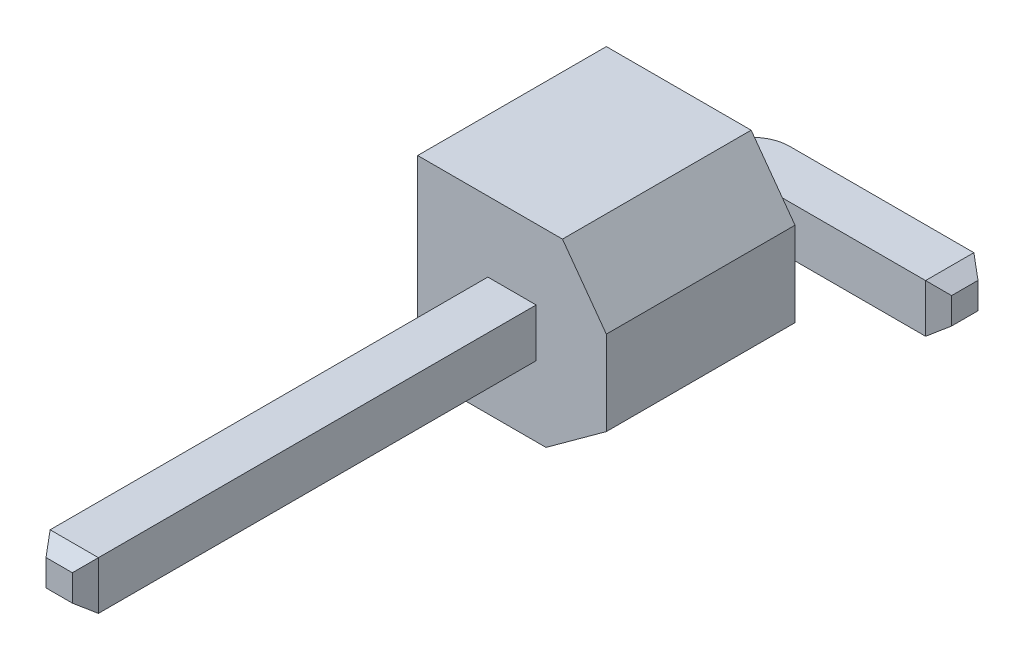
from build123d import *
from OCP.BRepFilletAPI import BRepFilletAPI_MakeChamfer

# Parameters (mm, degrees)
SKETCH_1_W           = 2.5
SKETCH_1_H           = 2.5
EXTRUDE_1_DEPTH      = 2.5
EXTRUDE_2_DEPTH      = 6
EXTRUDE_2_DEPTH_BACK = 3.5
SKETCH_2_W           = 0.64
SKETCH_2_H           = 0.64
SKETCH_4_W           = 0.64
SKETCH_4_H           = 0.64
EXTRUDE_4_DEPTH      = 2.5
FILLET_1_R           = 0.5
CHAMFER_1_SIZE       = 0.2
CHAMFER_1_SIZE2      = 0.145308506
CHAMFER_2_SIZE       = 0.8
CHAMFER_2_SIZE2      = 0.581234022


with BuildPart() as part:
    # Эскиз1 → Бобышка-Вытянуть1 (new body)
    with BuildSketch(Plane.XY.offset(1)):
        Rectangle(SKETCH_1_W, SKETCH_1_H)
    extrude(amount=EXTRUDE_1_DEPTH)

    # Эскиз2 → Бобышка-Вытянуть2 (add, two sides: drawn at the far end of the back side and taken through both)
    with BuildSketch(Plane.XY.offset(3.5).offset(-EXTRUDE_2_DEPTH_BACK)):
        Rectangle(SKETCH_2_W, SKETCH_2_H)
    extrude(amount=EXTRUDE_2_DEPTH + EXTRUDE_2_DEPTH_BACK)

    # Эскиз4 → Бобышка-Вытянуть4 (add)
    with BuildSketch(Plane(origin=(0.32, 0, 0), x_dir=(0, 0, -1), z_dir=(1, 0, 0))):
        with Locations((-0.32, 0)):
            Rectangle(SKETCH_4_W, SKETCH_4_H)
    extrude(amount=EXTRUDE_4_DEPTH)

    # Скругление1
    fillet_1_edges = [part.edges().sort_by_distance(p)[0] for p in [
        (-0.32, 0, 0),
    ]]
    fillet(fillet_1_edges, radius=FILLET_1_R)

    # Фаска1: one chamfer whose edges measure the first distance from different faces: ONE call of the kernel's chamfer builder (chamfer() names one face for all edges)
    chamfer_1_edges_1 = [part.edges().sort_by_distance(p)[0] for p in [
        (0.32, 0, 9.5),
    ]]
    chamfer_1_side_1 = [part.faces().sort_by_distance(p)[0] for p in [
        (0.32, 0, 6.5),
    ]]
    chamfer_1_edges_2 = [part.edges().sort_by_distance(p)[0] for p in [
        (0, 0.32, 9.5),
    ]]
    chamfer_1_side_2 = [part.faces().sort_by_distance(p)[0] for p in [
        (0, 0.32, 6.5),
    ]]
    chamfer_1_edges_3 = [part.edges().sort_by_distance(p)[0] for p in [
        (-0.32, 0, 9.5),
    ]]
    chamfer_1_side_3 = [part.faces().sort_by_distance(p)[0] for p in [
        (-0.32, 0, 6.5),
    ]]
    chamfer_1_edges_4 = [part.edges().sort_by_distance(p)[0] for p in [
        (0, -0.32, 9.5),
    ]]
    chamfer_1_side_4 = [part.faces().sort_by_distance(p)[0] for p in [
        (0, -0.32, 6.5),
    ]]
    chamfer_1_edges_5 = [part.edges().sort_by_distance(p)[0] for p in [
        (2.82, 0, 0),
    ]]
    chamfer_1_side_5 = [part.faces().sort_by_distance(p)[0] for p in [
        (1.5, 0, 0),
    ]]
    chamfer_1_edges_6 = [part.edges().sort_by_distance(p)[0] for p in [
        (2.82, 0.32, 0.32),
    ]]
    chamfer_1_side_6 = [part.faces().sort_by_distance(p)[0] for p in [
        (1.154058948, 0.32, 0.3778024),
    ]]
    chamfer_1_edges_7 = [part.edges().sort_by_distance(p)[0] for p in [
        (2.82, 0, 0.64),
    ]]
    chamfer_1_side_7 = [part.faces().sort_by_distance(p)[0] for p in [
        (1.57, 0, 0.64),
    ]]
    chamfer_1_edges_8 = [part.edges().sort_by_distance(p)[0] for p in [
        (2.82, -0.32, 0.32),
    ]]
    chamfer_1_side_8 = [part.faces().sort_by_distance(p)[0] for p in [
        (1.154058948, -0.32, 0.3778024),
    ]]
    chamfer_1 = BRepFilletAPI_MakeChamfer(part.part.solid().wrapped)
    for e in chamfer_1_edges_1:
        chamfer_1.Add(CHAMFER_1_SIZE, CHAMFER_1_SIZE2, e.wrapped, chamfer_1_side_1[0].wrapped)  # the first distance lies on this face
    for e in chamfer_1_edges_2:
        chamfer_1.Add(CHAMFER_1_SIZE, CHAMFER_1_SIZE2, e.wrapped, chamfer_1_side_2[0].wrapped)  # the first distance lies on this face
    for e in chamfer_1_edges_3:
        chamfer_1.Add(CHAMFER_1_SIZE, CHAMFER_1_SIZE2, e.wrapped, chamfer_1_side_3[0].wrapped)  # the first distance lies on this face
    for e in chamfer_1_edges_4:
        chamfer_1.Add(CHAMFER_1_SIZE, CHAMFER_1_SIZE2, e.wrapped, chamfer_1_side_4[0].wrapped)  # the first distance lies on this face
    for e in chamfer_1_edges_5:
        chamfer_1.Add(CHAMFER_1_SIZE, CHAMFER_1_SIZE2, e.wrapped, chamfer_1_side_5[0].wrapped)  # the first distance lies on this face
    for e in chamfer_1_edges_6:
        chamfer_1.Add(CHAMFER_1_SIZE, CHAMFER_1_SIZE2, e.wrapped, chamfer_1_side_6[0].wrapped)  # the first distance lies on this face
    for e in chamfer_1_edges_7:
        chamfer_1.Add(CHAMFER_1_SIZE, CHAMFER_1_SIZE2, e.wrapped, chamfer_1_side_7[0].wrapped)  # the first distance lies on this face
    for e in chamfer_1_edges_8:
        chamfer_1.Add(CHAMFER_1_SIZE, CHAMFER_1_SIZE2, e.wrapped, chamfer_1_side_8[0].wrapped)  # the first distance lies on this face
    add(Compound.cast(chamfer_1.Shape()), mode=Mode.REPLACE)

    # Фаска2: one chamfer whose edges measure the first distance from different faces: ONE call of the kernel's chamfer builder (chamfer() names one face for all edges)
    chamfer_2_edges_1 = [part.edges().sort_by_distance(p)[0] for p in [
        (1.25, -1.25, 2.25),
    ]]
    chamfer_2_side_1 = [part.faces().sort_by_distance(p)[0] for p in [
        (0, -1.25, 2.25),
    ]]
    chamfer_2_edges_2 = [part.edges().sort_by_distance(p)[0] for p in [
        (1.25, 1.25, 2.25),
    ]]
    chamfer_2_side_2 = [part.faces().sort_by_distance(p)[0] for p in [
        (1.25, 0, 2.25),
    ]]
    chamfer_2 = BRepFilletAPI_MakeChamfer(part.part.solid().wrapped)
    for e in chamfer_2_edges_1:
        chamfer_2.Add(CHAMFER_2_SIZE, CHAMFER_2_SIZE2, e.wrapped, chamfer_2_side_1[0].wrapped)  # the first distance lies on this face
    for e in chamfer_2_edges_2:
        chamfer_2.Add(CHAMFER_2_SIZE, CHAMFER_2_SIZE2, e.wrapped, chamfer_2_side_2[0].wrapped)  # the first distance lies on this face
    add(Compound.cast(chamfer_2.Shape()), mode=Mode.REPLACE)


solid = part.part
